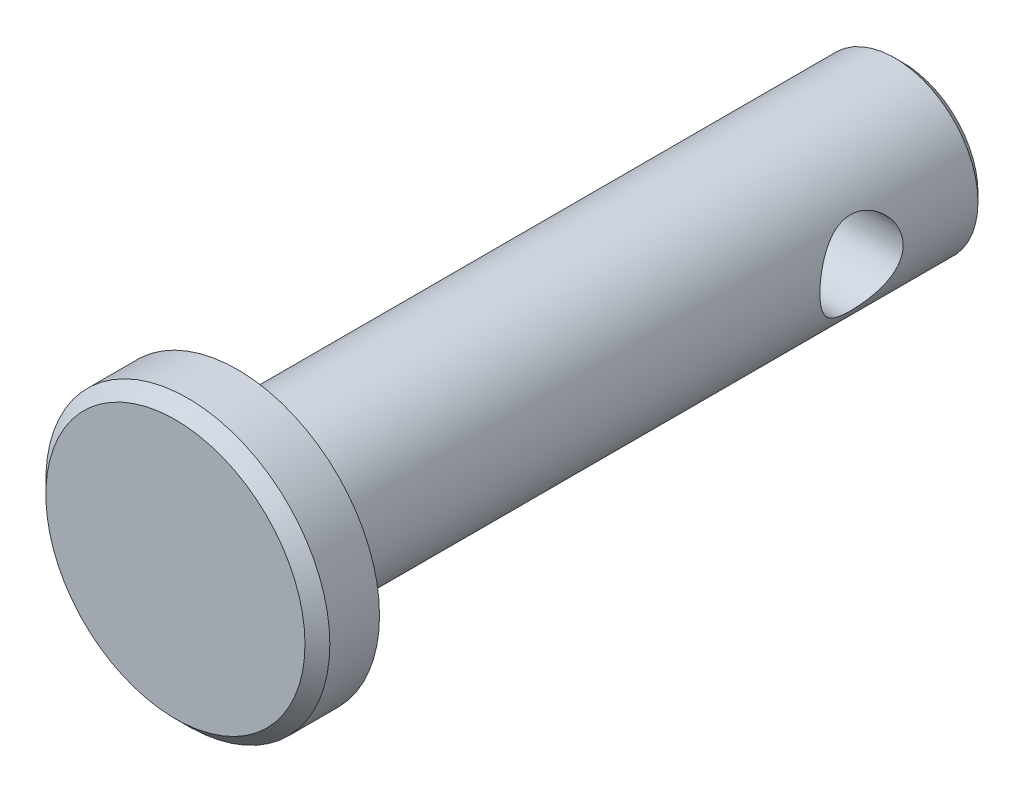
from build123d import *

# Parameters (mm, degrees)
SKETCH1_R           = 2.38125
EXTRUDE1_DEPTH      = 9.525
SKETCH2_R           = 4.064
EXTRUDE2_DEPTH      = 1.778
CHAMFER1_SIZE       = 0.3556
EXTRUDE3_DEPTH      = 13.68029972
EXTRUDE3_DEPTH_BACK = 13.68029972
SKETCH3_R           = 1.190625
CHAMFER2_SIZE       = 0.238125


with BuildPart() as part:
    # Sketch1 → Extrude1 (new, symmetric)
    with BuildSketch(Plane.XY):
        with Locations(Location((0, 0, 0), (0, 0, 180))):
            Circle(SKETCH1_R)
    extrude(amount=EXTRUDE1_DEPTH, both=True)

    # Sketch2 → Extrude2 (add)
    with BuildSketch(Plane.XY.offset(9.525)):
        Circle(SKETCH2_R)
    extrude(amount=EXTRUDE2_DEPTH)

    # Chamfer1
    chamfer1_edges = [part.edges().sort_by_distance(p)[0] for p in [
        (-4.064, 0, 11.303),
    ]]
    chamfer(chamfer1_edges, length=CHAMFER1_SIZE)

    # Sketch3 → Extrude3 (cut, two sides: drawn at the far end of the back side and taken through both)
    with BuildSketch(Plane(origin=(0, 0, 0), x_dir=(0, 0, -1), z_dir=(1, 0, 0)).offset(-EXTRUDE3_DEPTH_BACK)):
        with Locations(Location((5.953125, 0, 0), (0, 0, 179.999999999))):
            Circle(SKETCH3_R)
    extrude(amount=EXTRUDE3_DEPTH + EXTRUDE3_DEPTH_BACK, mode=Mode.SUBTRACT)

    # Chamfer2
    chamfer2_edges = [part.edges().sort_by_distance(p)[0] for p in [
        (2.38125, 0, -9.525),
    ]]
    chamfer(chamfer2_edges, length=CHAMFER2_SIZE)


solid = part.part
